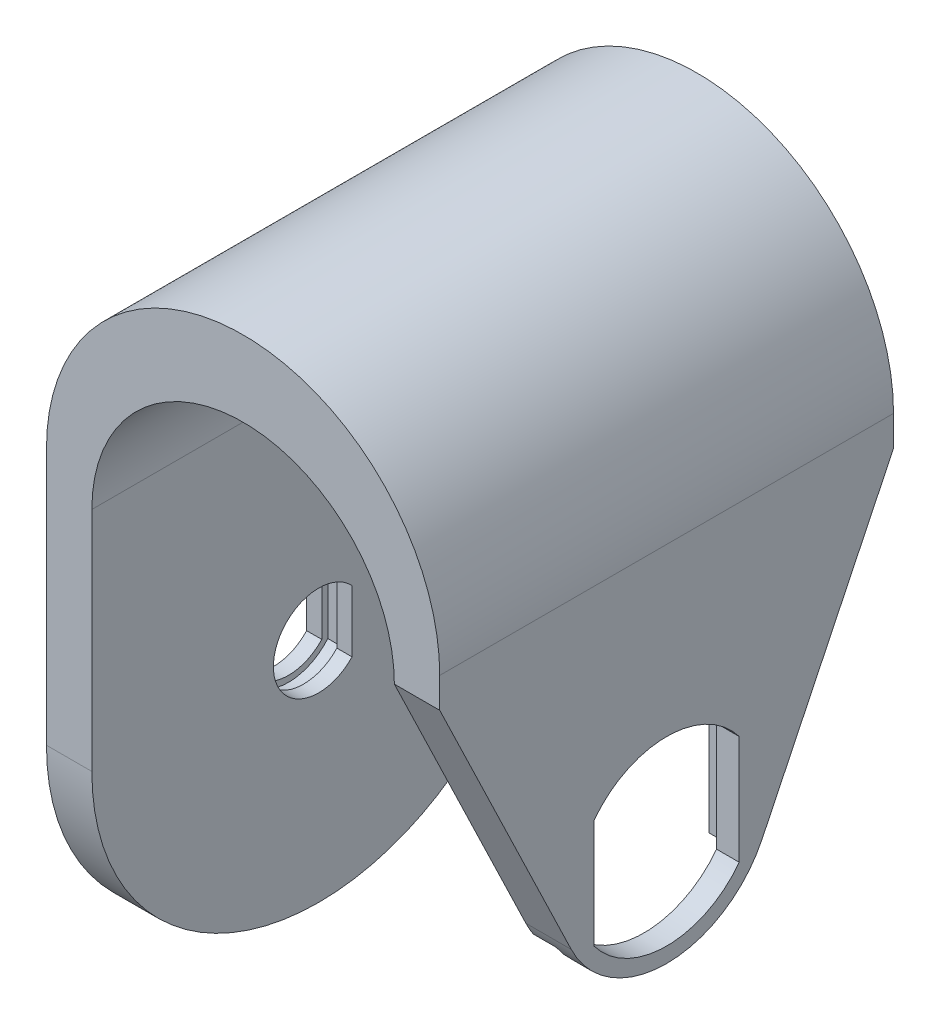
from build123d import *

# Parameters (mm, degrees)
EXTRUDE_BODY_DEPTH       = 37.5
EXTRCUT_BEVELS_DEPTH     = 93.837223138
EXTRCUT_ROUNDBEVEL_DEPTH = 93.837223138
CUT_EXTRUDE13_DEPTH      = 3.75
CUT_EXTRUDE14_REACH      = 94.837
CUT_EXTRUDE15_REACH      = 99.66
CUT_EXTRUDE16_DEPTH      = 1.25


with BuildPart() as part:
    # Sketch3 → Extrude_Body (new, symmetric)
    with BuildSketch(Plane.XY):
        with BuildLine():
            Line((-25, 25), (-25, -50))
            Line((-25, -50), (-32.5, -50))
            Line((-32.5, -50), (-32.5, 30))
            ThreePointArc((-32.5, 30), (0, 62.5), (32.5, 30))
            Line((32.5, 30), (32.5, -50))
            Line((32.5, -50), (25, -50))
            Line((25, -50), (25, 25))
            ThreePointArc((25, 25), (0, 50), (-25, 25))
        make_face()
    extrude(amount=EXTRUDE_BODY_DEPTH, both=True)

    # Sketch4 → ExtrCut_Bevels (cut, through all)
    with BuildSketch(Plane.ZY.offset(-25)):
        with BuildLine():
            Line((37.5, 25), (42.5, 25))
            Line((42.5, 25), (42.5, -55.000533297))
            Line((42.5, -55.000533297), (-42.499327473, -55.000533297))
            Line((-42.499327473, -55.000533297), (-42.499327473, 24.999466703))
            Line((-42.499327473, 24.999466703), (-37.499327473, 24.999466703))
            Line((-37.499327473, 24.999466703), (-15.764161078, -20.098506949))
            ThreePointArc((-15.764161078, -20.098506949), (0.000531023, -30.000682397), (15.76513551, -20.098367466))
            Line((15.76513551, -20.098367466), (37.5, 25))
        make_face()
    extrude(amount=-EXTRCUT_BEVELS_DEPTH, mode=Mode.SUBTRACT)

    # Sketch8 → ExtrCut_RoundBevel (cut, through all)
    with BuildSketch(Plane(origin=(-25, 0, 0), x_dir=(0, 0, -1), z_dir=(1, 0, 0))):
        with BuildLine():
            Line((-37.5, -12.5), (-42.5, -12.5))
            Line((-42.5, -12.5), (-42.5, -53.627772483))
            Line((-42.5, -53.627772483), (42.5, -53.627772483))
            Line((42.5, -53.627772483), (42.5, -12.5))
            Line((42.5, -12.5), (37.5, -12.5))
            ThreePointArc((37.5, -12.5), (0, -50), (-37.5, -12.5))
        make_face()
    extrude(amount=-EXTRCUT_ROUNDBEVEL_DEPTH, mode=Mode.SUBTRACT)

    # Sketch34 → Cut-Extrude13 (cut, symmetric)
    with BuildSketch(Plane.ZY.offset(-25)):
        with BuildLine():
            Line((-14.499546396, -2.702721459), (-14.499546396, -22.298641924))
            ThreePointArc((-14.499546396, -22.298641924), (0.000453604, -30.000682398), (14.500453604, -22.298641924))
            Line((14.500453604, -22.298641924), (14.500453604, -2.702721459))
            ThreePointArc((14.500453604, -2.702721459), (0.000453604, 4.999319015), (-14.499546396, -2.702721459))
        make_face()
    extrude(amount=CUT_EXTRUDE13_DEPTH, both=True, mode=Mode.SUBTRACT)

    # Sketch35 → Cut-Extrude14 (cut, up to next)
    with BuildSketch(Plane.ZY.offset(-25), mode=Mode.PRIVATE) as cut_extrude14_sk1:
        with BuildLine():
            Line((-11.999546396, -3.500681691), (-11.999546396, -21.500681691))
            ThreePointArc((-11.999546396, -21.500681691), (0.000453604, -27.500681691), (12.000453604, -21.500681691))
            Line((12.000453604, -21.500681691), (12.000453604, -3.500681691))
            ThreePointArc((12.000453604, -3.500681691), (0.000453604, 2.499318309), (-11.999546396, -3.500681691))
        make_face()
    cut_extrude14_tool1 = extrude(cut_extrude14_sk1.sketch, amount=-CUT_EXTRUDE14_REACH, mode=Mode.PRIVATE) & part.part
    add(cut_extrude14_tool1.solids().sort_by_distance((25, -12.500682, 0.000454))[0], mode=Mode.SUBTRACT)

    # Sketch36 → Cut-Extrude15 (cut, up to next)
    with BuildSketch(Plane.ZY.offset(32.5), mode=Mode.PRIVATE) as cut_extrude15_sk1:
        with BuildLine():
            Line((-5.5, -7.400980486), (-5.5, -17.599019514))
            ThreePointArc((-5.5, -17.599019514), (7.5, -12.5), (-5.5, -7.400980486))
        make_face()
    cut_extrude15_tool1 = extrude(cut_extrude15_sk1.sketch, amount=-CUT_EXTRUDE15_REACH, mode=Mode.PRIVATE) & part.part
    add(cut_extrude15_tool1.solids().sort_by_distance((-32.5, -12.5, 0.543202))[0], mode=Mode.SUBTRACT)

    # Sketch37 → Cut-Extrude16 (cut, symmetric)
    with BuildSketch(Plane(origin=(-28.75, 0, 0), x_dir=(0, 0, -1), z_dir=(1, 0, 0))):
        with BuildLine():
            Line((6.5, -7.022774425), (6.5, -17.977225575))
            ThreePointArc((6.5, -17.977225575), (-8.5, -12.5), (6.5, -7.022774425))
        make_face()
    extrude(amount=CUT_EXTRUDE16_DEPTH, both=True, mode=Mode.SUBTRACT)


solid = part.part
